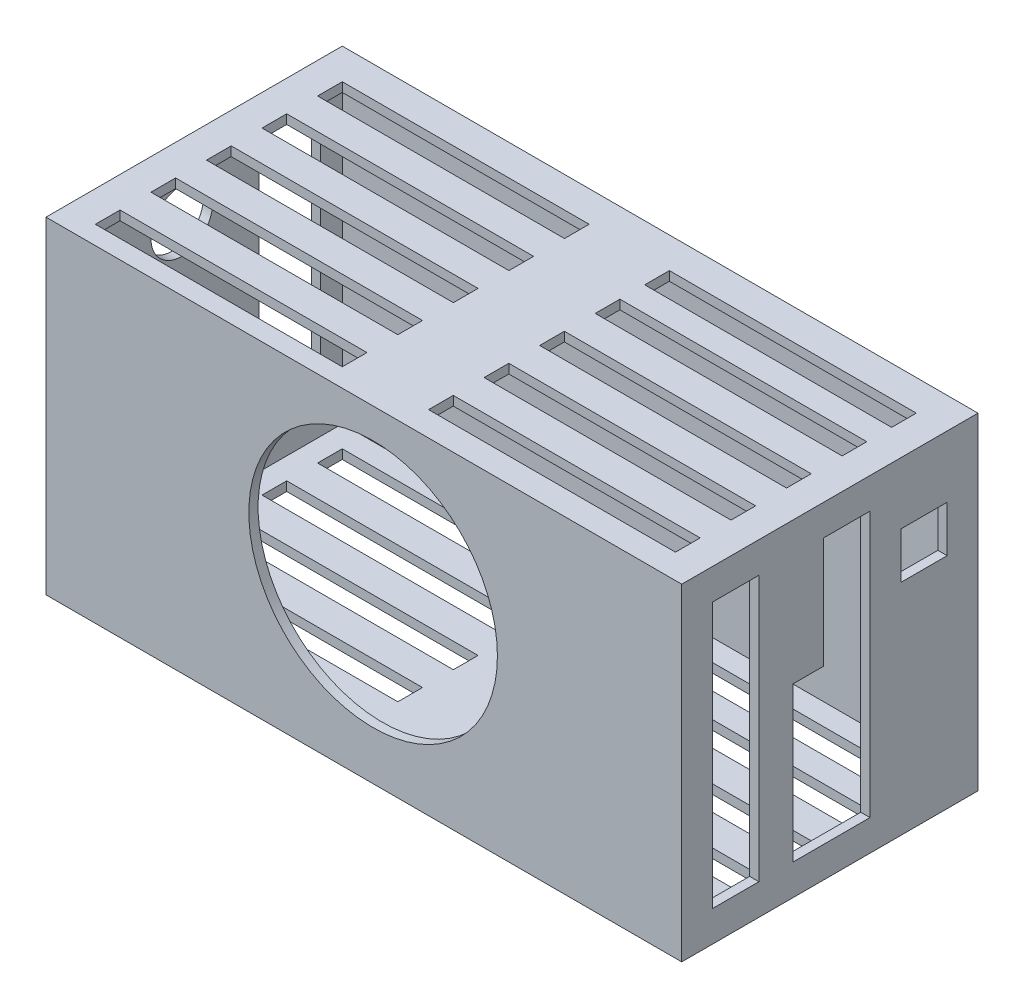
from build123d import *

# Parameters (mm, degrees)
SKETCH1_W           = 206
SKETCH1_H           = 106
SKETCH1_W_2         = 200
SKETCH1_H_2         = 100
EXTRUDE_THIN1_DEPTH = 90
SKETCH2_W           = 206
SKETCH2_H           = 106
BOSS_EXTRUDE1_DEPTH = 3
SKETCH4_W           = 206
SKETCH4_H           = 106
BOSS_EXTRUDE2_DEPTH = 3
SKETCH5_R           = 40.274821778
CUT_EXTRUDE1_DEPTH  = 6
SKETCH6_W           = 80
SKETCH6_H           = 8
CUT_EXTRUDE2_DEPTH  = 150
SKETCH8_R           = 10
SKETCH8_W           = 20
SKETCH8_H           = 86
CUT_EXTRUDE3_DEPTH  = 10
SKETCH9_W           = 15
SKETCH9_H           = 15
SKETCH9_H_2         = 86
CUT_EXTRUDE4_DEPTH  = 10


with BuildPart() as part:
    # Sketch1 → Extrude-Thin1 (new body)
    with BuildSketch(Plane.XY):
        with Locations((25.793650794, -8.928571429)):
            Rectangle(SKETCH1_W, SKETCH1_H)
        with Locations((25.793650794, -8.928571429)):
            Rectangle(SKETCH1_W_2, SKETCH1_H_2, mode=Mode.SUBTRACT)
    extrude(amount=EXTRUDE_THIN1_DEPTH)

    # Sketch2 → Boss-Extrude1 (add)
    with BuildSketch(Plane(origin=(0, 0, 0), x_dir=(-1, 0, 0), z_dir=(0, 0, -1))):
        with Locations((-25.793650794, -8.928571429)):
            Rectangle(SKETCH2_W, SKETCH2_H)
    extrude(amount=BOSS_EXTRUDE1_DEPTH)

    # Sketch4 → Boss-Extrude2 (add)
    with BuildSketch(Plane.XY.offset(90)):
        with Locations((25.793650794, -8.928571429)):
            Rectangle(SKETCH4_W, SKETCH4_H)
    extrude(amount=BOSS_EXTRUDE2_DEPTH)

    # Sketch5 → Cut-Extrude1 (cut)
    with BuildSketch(Plane.XY.offset(93)):
        with Locations((28.793650794, -5.928571429)):
            Circle(SKETCH5_R)
    extrude(amount=-CUT_EXTRUDE1_DEPTH, mode=Mode.SUBTRACT)

    # Sketch6 → Cut-Extrude2 (cut)
    with BuildSketch(Plane(origin=(0, 44.071428571, 0), x_dir=(1, 0, 0), z_dir=(0, 1, 0))):
        with Locations((-27.206349206, -11)):
            Rectangle(SKETCH6_W, SKETCH6_H)
        with Locations((78.793650794, -11)):
            Rectangle(SKETCH6_W, SKETCH6_H)
        with Locations((78.793650794, -27.034238135)):
            Rectangle(SKETCH6_W, SKETCH6_H)
        with Locations((78.793650794, -45.034238135)):
            Rectangle(SKETCH6_W, SKETCH6_H)
        with Locations((78.793650794, -63.034238135)):
            Rectangle(SKETCH6_W, SKETCH6_H)
        with Locations((78.793650794, -81.034238135)):
            Rectangle(SKETCH6_W, SKETCH6_H)
        with Locations((-27.206349206, -29)):
            Rectangle(SKETCH6_W, SKETCH6_H)
        with Locations((-27.206349206, -47)):
            Rectangle(SKETCH6_W, SKETCH6_H)
        with Locations((-27.206349206, -65)):
            Rectangle(SKETCH6_W, SKETCH6_H)
        with Locations((-27.206349206, -83)):
            Rectangle(SKETCH6_W, SKETCH6_H)
    extrude(amount=-CUT_EXTRUDE2_DEPTH, mode=Mode.SUBTRACT)

    # Sketch8 → Cut-Extrude3 (cut)
    with BuildSketch(Plane.ZY.offset(77.206349206)):
        with Locations((52, 24.071428571)):
            Circle(SKETCH8_R)
        with Locations((52, -41.928571429)):
            Circle(SKETCH8_R)
        with Locations((17, -8.928571429)):
            Rectangle(SKETCH8_W, SKETCH8_H)
    extrude(amount=-CUT_EXTRUDE3_DEPTH, mode=Mode.SUBTRACT)

    # Sketch9 → Cut-Extrude4 (cut)
    with BuildSketch(Plane(origin=(128.793650794, 0, 0), x_dir=(0, 0, -1), z_dir=(1, 0, 0))):
        Polygon((-32, 34.071428571), (-32, -51.928571429), (-57, -51.928571429), (-57, -1.928571429), (-47, -1.928571429), (-47, 34.071428571), align=None)
        with Locations((-14.5, 16.571428571)):
            Rectangle(SKETCH9_W, SKETCH9_H)
        with Locations((-75.5, -8.928571429)):
            Rectangle(SKETCH9_W, SKETCH9_H_2)
    extrude(amount=-CUT_EXTRUDE4_DEPTH, mode=Mode.SUBTRACT)


solid = part.part
